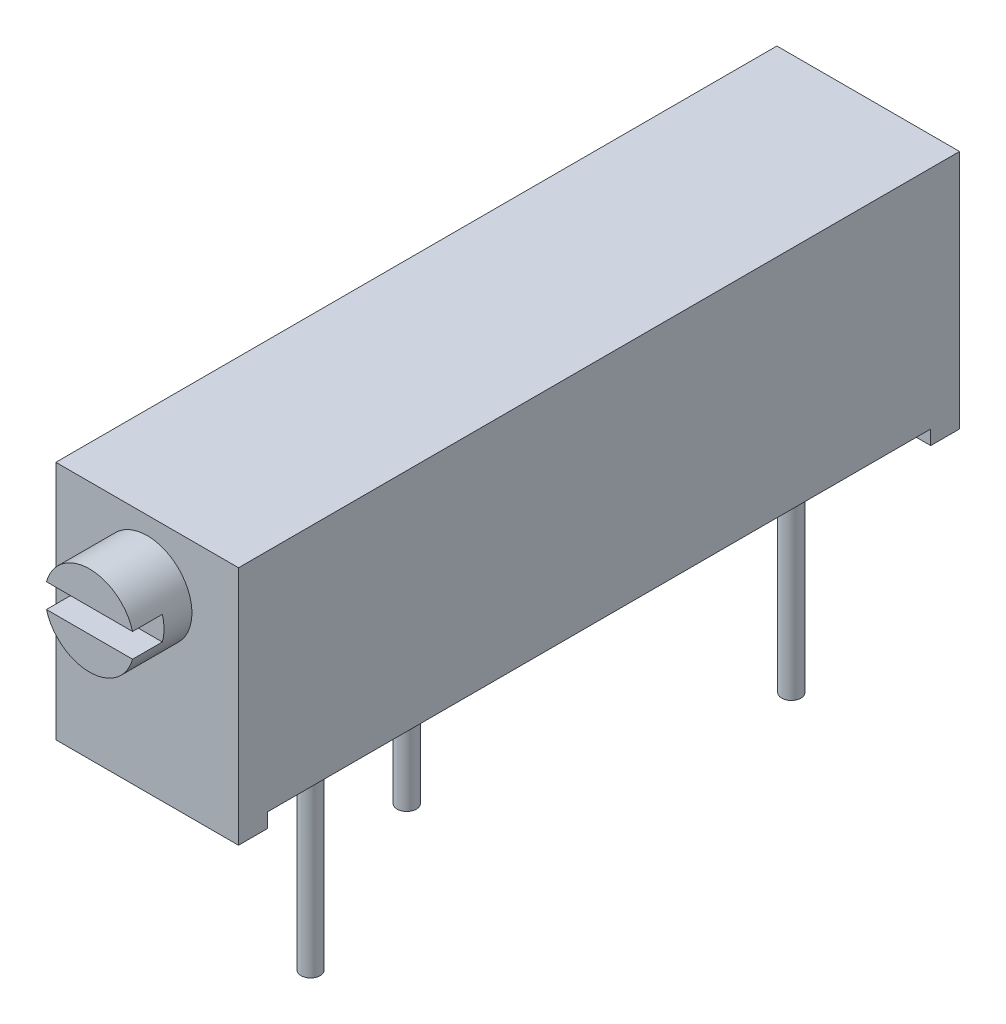
from build123d import *

# Parameters (mm, degrees)
EXTRUDE1_DEPTH     = 2.413
SKETCH2_R          = 1.1811
EXTRUDE2_DEPTH     = 1.524
SKETCH3_W          = 3.103966911
SKETCH3_H          = 0.635
CUT_EXTRUDE1_DEPTH = 0.7874
SKETCH4_R          = 0.254
EXTRUDE3_DEPTH     = 5.588


with BuildPart() as part:
    # Sketch1 → Extrude1 (new, symmetric)
    with BuildSketch(Plane(origin=(0, 0, 0), x_dir=(0, 0, -1), z_dir=(1, 0, 0))):
        Polygon((-9.525, 3.175), (9.525, 3.175), (9.525, -3.175), (8.763, -3.175), (8.763, -2.794), (-8.763, -2.794), (-8.763, -3.175), (-9.525, -3.175), align=None)
    extrude(amount=EXTRUDE1_DEPTH, both=True)

    # Sketch2 → Extrude2 (add)
    with BuildSketch(Plane.XY.offset(9.525)):
        with Locations(Location((0, 1.524, 0), (0, 0, 180))):
            Circle(SKETCH2_R)
    extrude(amount=EXTRUDE2_DEPTH)

    # Sketch3 → Cut-Extrude1 (cut)
    with BuildSketch(Plane.XY.offset(11.049)):
        with Locations((-0.005969167, 1.524)):
            Rectangle(SKETCH3_W, SKETCH3_H)
    extrude(amount=-CUT_EXTRUDE1_DEPTH, mode=Mode.SUBTRACT)

    # Sketch4 → Extrude3 (add)
    with BuildSketch(Plane.XZ.offset(2.794)):
        with Locations(Location((1.016, 6.223, 0), (0, 0, 90))):
            Circle(SKETCH4_R)
        with Locations(Location((-1.524, 1.143, 0), (0, 0, 90))):
            Circle(SKETCH4_R)
        with Locations(Location((1.016, -6.477, 0), (0, 0, 90))):
            Circle(SKETCH4_R)
    extrude(amount=EXTRUDE3_DEPTH)


solid = part.part
